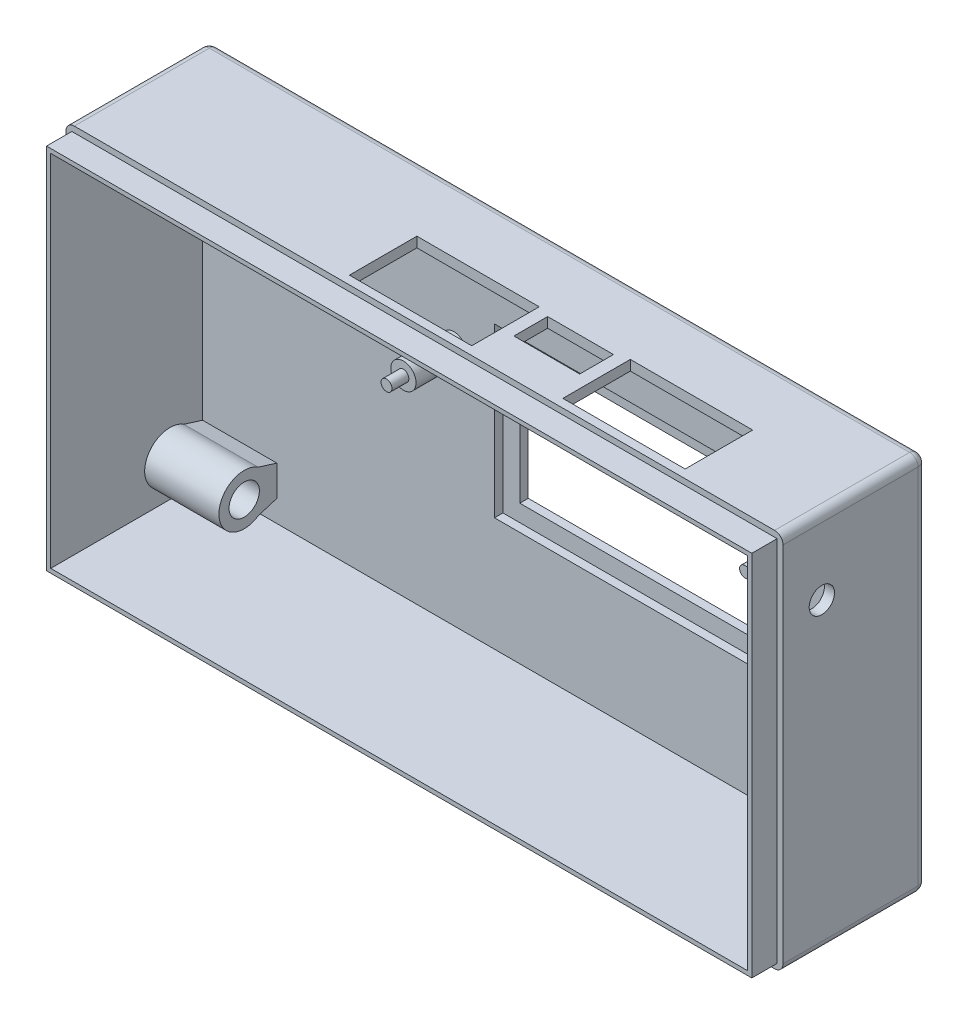
from build123d import *

# Parameters (mm, degrees)
SKETCH_1_W          = 85
SKETCH_1_H          = 45
EXTRUDE_1_DEPTH     = 20
SKETCH_2_W          = 82.6
SKETCH_2_H          = 42.6
CUT_EXTRUDE_1_DEPTH = 18
SKETCH_3_R          = 52.564832307
SKETCH_3_W          = 83.6
SKETCH_3_H          = 43.6
CUT_EXTRUDE_2_DEPTH = 3
SKETCH_4_R          = 1.5
CUT_EXTRUDE_3_DEPTH = 10
SKETCH_6_R          = 1.5
EXTRUDE_2_DEPTH     = 6
SKETCH_7_R          = 0.65
EXTRUDE_3_DEPTH     = 2
SKETCH_5_W          = 28
SKETCH_5_H          = 15.9
CUT_EXTRUDE_4_DEPTH = 99.234413522
SKETCH_9_W          = 32
SKETCH_9_H          = 19.9
CUT_EXTRUDE_5_DEPTH = 1
SKETCH_10_W         = 14.5
SKETCH_10_H         = 8
SKETCH_10_W_2       = 7.8
SKETCH_10_H_2       = 4
CUT_EXTRUDE_6_DEPTH = 10
FILLET_1_R          = 1
SKETCH_11_R         = 1.8
EXTRUDE_4_DEPTH     = 10
SKETCH_12_R         = 1.8
CUT_EXTRUDE_7_DEPTH = 90.721792225
SKETCH_13_R         = 2.425
CUT_EXTRUDE_8_DEPTH = 98.846819059


with BuildPart() as part:
    # Эскиз1 → Бобышка-Вытянуть1 (new body)
    with BuildSketch(Plane.XY):
        with Locations((42.5, 22.5)):
            Rectangle(SKETCH_1_W, SKETCH_1_H)
    extrude(amount=EXTRUDE_1_DEPTH)

    # Эскиз2 → Вырез-Вытянуть1 (cut)
    with BuildSketch(Plane.XY.offset(20)):
        with Locations((42.5, 22.5)):
            Rectangle(SKETCH_2_W, SKETCH_2_H)
    extrude(amount=-CUT_EXTRUDE_1_DEPTH, mode=Mode.SUBTRACT)

    # Эскиз3 → Вырез-Вытянуть2 (cut)
    with BuildSketch(Plane.XY.offset(20)):
        with Locations((42.5, 22.5)):
            Circle(SKETCH_3_R)
        with Locations((42.5, 22.5)):
            Rectangle(SKETCH_3_W, SKETCH_3_H, mode=Mode.SUBTRACT)
    extrude(amount=-CUT_EXTRUDE_2_DEPTH, mode=Mode.SUBTRACT)

    # Эскиз4 → Вырез-Вытянуть3 (cut)
    with BuildSketch(Plane.ZY.offset(-85)):
        with Locations(Location((12.4, 36.05, 0), (0, 0, 180))):
            Circle(SKETCH_4_R)
    extrude(amount=CUT_EXTRUDE_3_DEPTH, mode=Mode.SUBTRACT)

    # Эскиз6 → Бобышка-Вытянуть2 (add)
    with BuildSketch(Plane.XY.offset(2)):
        with Locations((31, 29.89)):
            Circle(SKETCH_6_R)
        with Locations((73.5, 32)):
            Circle(SKETCH_6_R)
    extrude(amount=EXTRUDE_2_DEPTH)

    # Эскиз7 → Бобышка-Вытянуть3 (add)
    with BuildSketch(Plane.XY.offset(8)):
        with Locations((31, 29.89)):
            Circle(SKETCH_7_R)
        with Locations((73.5, 32)):
            Circle(SKETCH_7_R)
    extrude(amount=EXTRUDE_3_DEPTH)

    # Эскиз5 → Вырез-Вытянуть4 (cut, through all)
    with BuildSketch(Plane(origin=(0, 0, 0), x_dir=(-1, 0, 0), z_dir=(0, 0, -1))):
        with Locations((-51.8, 24.64)):
            Rectangle(SKETCH_5_W, SKETCH_5_H)
    extrude(amount=-CUT_EXTRUDE_4_DEPTH, mode=Mode.SUBTRACT)

    # Эскиз9 → Вырез-Вытянуть5 (cut)
    with BuildSketch(Plane.XY.offset(2)):
        with Locations((51.8, 24.64)):
            Rectangle(SKETCH_9_W, SKETCH_9_H)
    extrude(amount=-CUT_EXTRUDE_5_DEPTH, mode=Mode.SUBTRACT)

    # Эскиз10 → Вырез-Вытянуть6 (cut)
    with BuildSketch(Plane.XZ.offset(-45)):
        with Locations((39.85, 12)):
            Rectangle(SKETCH_10_W, SKETCH_10_H)
        with Locations((65.15, 12)):
            Rectangle(SKETCH_10_W, SKETCH_10_H)
        with Locations((52.5, 10.5)):
            Rectangle(SKETCH_10_W_2, SKETCH_10_H_2)
    extrude(amount=CUT_EXTRUDE_6_DEPTH, mode=Mode.SUBTRACT)

    # Скругление1
    fillet_1_edges = [part.edges().sort_by_distance(p)[0] for p in [
        (0, 45, 8.5),
        (85, 45, 8.5),
        (85, 0, 8.5),
        (0, 0, 8.5),
        (42.5, 45, 0),
        (85, 22.5, 0),
        (42.5, 0, 0),
        (0, 22.5, 0),
    ]]
    fillet(fillet_1_edges, radius=FILLET_1_R)

    # Эскиз11 → Бобышка-Вытянуть4 (add)
    with BuildSketch(Plane.ZY):
        with BuildLine():
            Line((1, 7.094213846), (1, 4.094213846))
            Line((1, 4.094213846), (4.208818791, 3.094213846))
            ThreePointArc((4.208818791, 3.094213846), (8.867131186, 5.594213846), (4.208818791, 8.094213846))
            Line((4.208818791, 8.094213846), (1, 7.094213846))
        make_face()
        with Locations((5.867131186, 5.594213846)):
            Circle(SKETCH_11_R, mode=Mode.SUBTRACT)
    extrude(amount=-EXTRUDE_4_DEPTH)

    # Эскиз12 → Вырез-Вытянуть7 (cut, through all)
    with BuildSketch(Plane(origin=(10, 0, 0), x_dir=(0, 0, -1), z_dir=(1, 0, 0))):
        with Locations(Location((-5.867131186, 5.594213846, 0), (0, 0, 180))):
            Circle(SKETCH_12_R)
    extrude(amount=-CUT_EXTRUDE_7_DEPTH, mode=Mode.SUBTRACT)

    # Эскиз13 → Вырез-Вытянуть8 (cut, through all)
    with BuildSketch(Plane.XY.offset(2)):
        with Locations((7, 37.89)):
            Circle(SKETCH_13_R)
    extrude(amount=-CUT_EXTRUDE_8_DEPTH, mode=Mode.SUBTRACT)


solid = part.part
